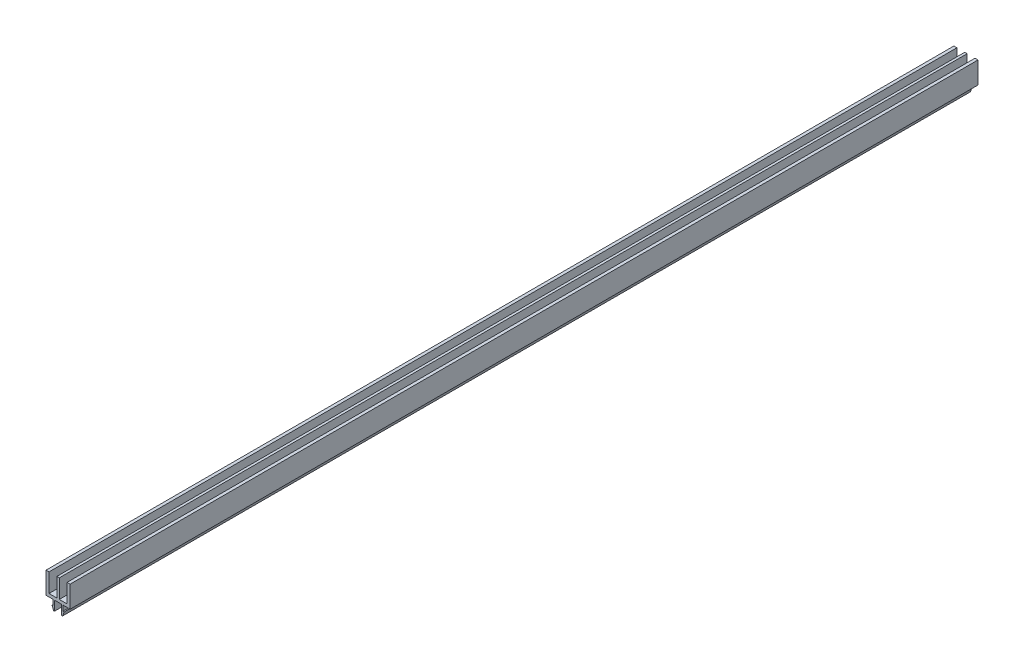
from build123d import *

# Parameters (mm, degrees)
BOSS_EXTRU_1_DEPTH = 752


with BuildPart() as part:
    # Esquisse1 → Boss.-Extru.1 (new body)
    with BuildSketch(Plane.XY.offset(50)):
        Polygon((-1, 2.5), (-7.5, 2.5), (-7.5, 17.999999998), (-10, 17.999999998), (-10, 0), (-4, 0), (-4, -4.5), (-5, -4.5), (-3.75, -8), (-3, -8), (-3, 0), (3, 0), (3, -8), (3.75, -8), (5, -4.5), (4, -4.5), (4, 0), (10, 0), (10, 17.999999998), (7.5, 17.999999998), (7.5, 2.5), (1, 2.5), (1, 17.999999998), (-1, 17.999999998), align=None)
    extrude(amount=-BOSS_EXTRU_1_DEPTH)


solid = part.part
